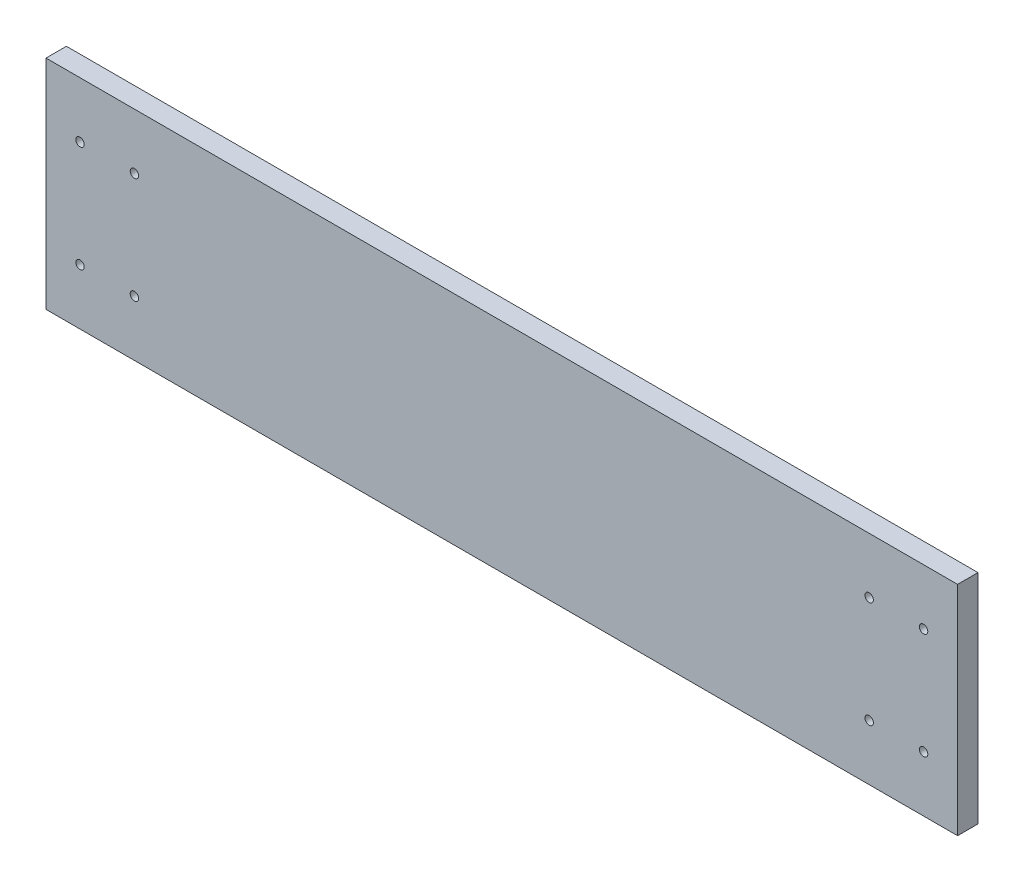
from build123d import *

# Parameters (mm, degrees)
SKETCH1_W               = 850.9
SKETCH1_H               = 203.2
BOSS_EXTRUDE1_DEPTH     = 19.05
ESQUISSE1_R             = 3.937
ENL_V_MAT_EXTRU_1_DEPTH = 876.033686494


with BuildPart() as part:
    # Sketch1 → Boss-Extrude1 (new body)
    with BuildSketch(Plane.XY):
        with Locations((425.45, 101.6)):
            Rectangle(SKETCH1_W, SKETCH1_H)
    extrude(amount=BOSS_EXTRUDE1_DEPTH)

    # Esquisse1 → Enlèv. mat.-Extru.1 (cut, through all)
    with BuildSketch(Plane(origin=(0, 0, 0), x_dir=(-1, 0, 0), z_dir=(0, 0, -1))):
        with Locations((-819.15, 151.2)):
            Circle(ESQUISSE1_R)
        with Locations((-768.35, 151.2)):
            Circle(ESQUISSE1_R)
        with Locations((-768.35, 52)):
            Circle(ESQUISSE1_R)
        with Locations((-819.15, 52)):
            Circle(ESQUISSE1_R)
        with Locations((-82.55, 151.2)):
            Circle(ESQUISSE1_R)
        with Locations((-31.75, 151.2)):
            Circle(ESQUISSE1_R)
        with Locations((-31.75, 52)):
            Circle(ESQUISSE1_R)
        with Locations((-82.55, 52)):
            Circle(ESQUISSE1_R)
    extrude(amount=-ENL_V_MAT_EXTRU_1_DEPTH, mode=Mode.SUBTRACT)


solid = part.part
